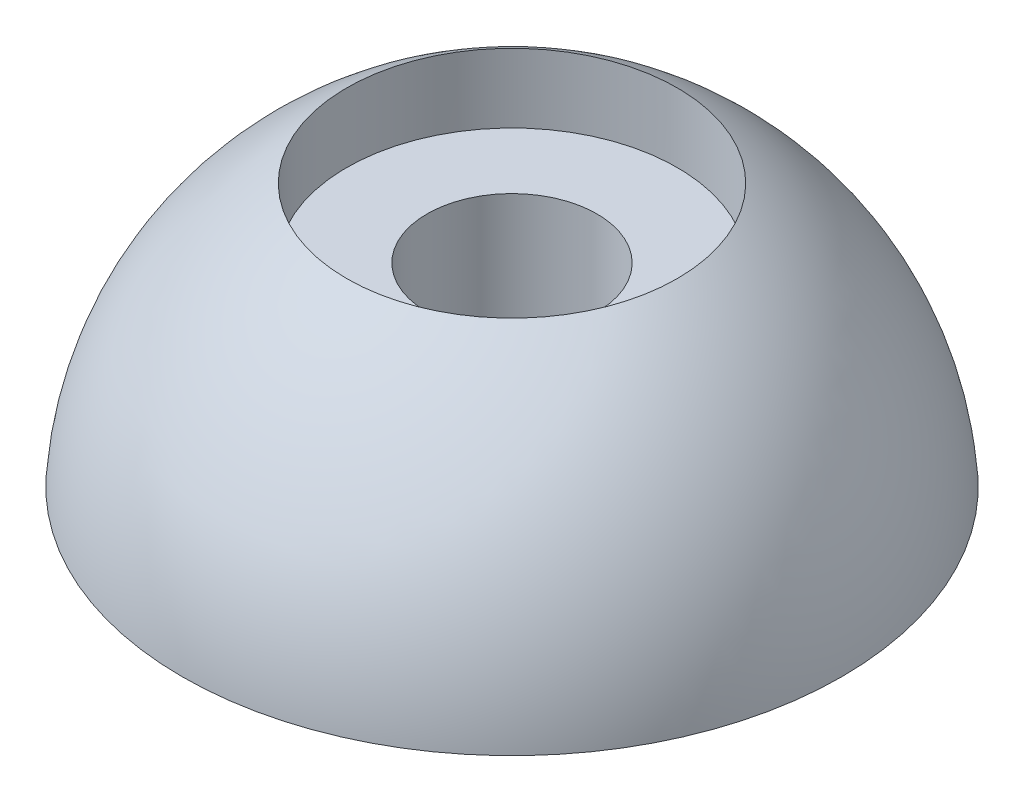
from build123d import *

# Parameters (mm, degrees)
CBORE_FOR_M3_PAN_HEAD_SCREW1_D           = 3.6
CBORE_FOR_M3_PAN_HEAD_SCREW1_CBORE_D     = 7
CBORE_FOR_M3_PAN_HEAD_SCREW1_CBORE_DEPTH = 2.4


with BuildPart() as part:
    # Sketch1 → Revolve1 (revolve)
    with BuildSketch(Plane.XY):
        with BuildLine():
            Line((0, 0), (0, 6.5))
            ThreePointArc((0, 6.5), (4.769696007, 4.623475383), (6.982120022, 0))
            Line((6.982120022, 0), (0, 0))
        make_face()
    revolve(axis=Axis((0, 58.277719589, 0), (0, -1, 0)))

    # CBORE for M3 Pan Head Screw1 (through all)
    with Locations(Plane(origin=(0, 6.5, 0), x_dir=(1, 0, 0), z_dir=(0, 1, 0))):
        with Locations((0, 0)):
            CounterBoreHole(CBORE_FOR_M3_PAN_HEAD_SCREW1_D / 2, CBORE_FOR_M3_PAN_HEAD_SCREW1_CBORE_D / 2, CBORE_FOR_M3_PAN_HEAD_SCREW1_CBORE_DEPTH)


solid = part.part
